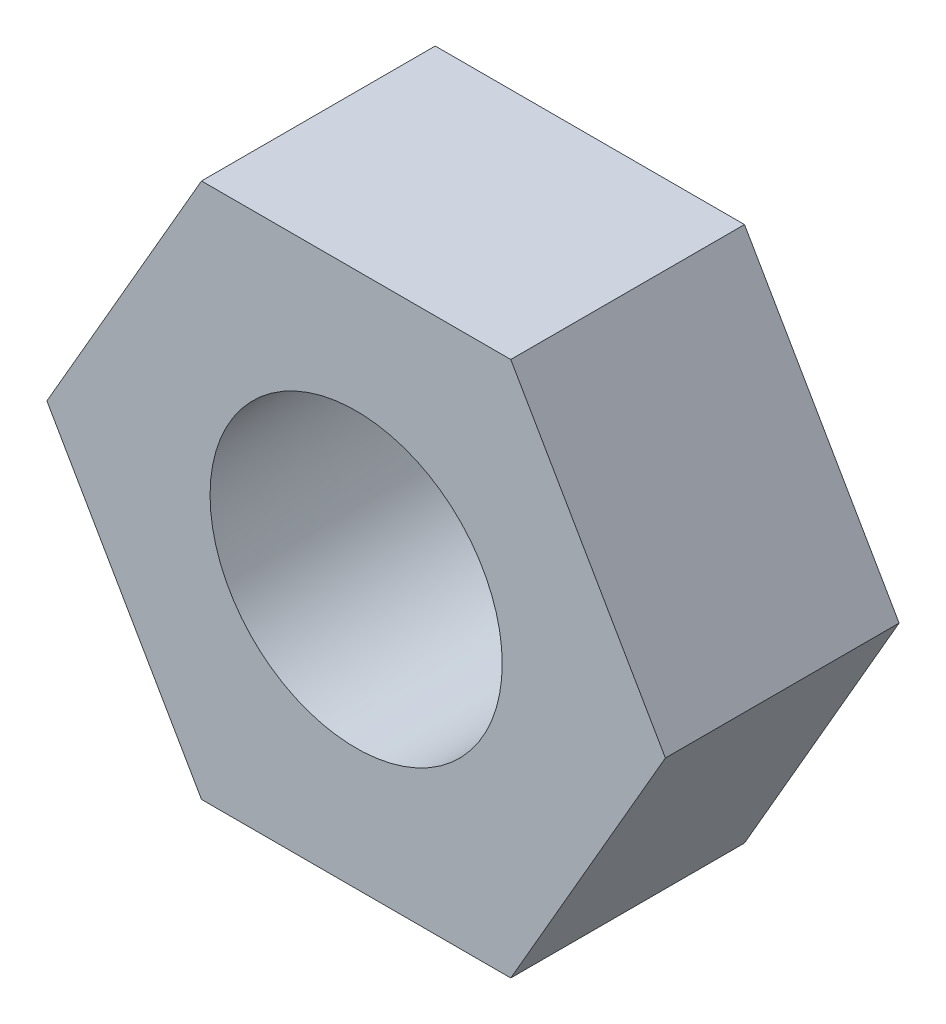
from build123d import *

# Parameters (mm, degrees)
ACROSS_FLATS_5_5_R                   = 1.5
NUT_THREAD_ENVELOPE_HEIGHT_2_4_DEPTH = 2.4


with BuildPart() as part:
    # Across_flats_5.5 → Nut_thread_envelope_height_2.4 (new body)
    with BuildSketch(Plane.XY):
        Polygon((3.175426481, 0), (1.58771324, 2.75), (-1.58771324, 2.75), (-3.175426481, 0), (-1.58771324, -2.75), (1.58771324, -2.75), align=None)
        Circle(ACROSS_FLATS_5_5_R, mode=Mode.SUBTRACT)
    extrude(amount=NUT_THREAD_ENVELOPE_HEIGHT_2_4_DEPTH)


solid = part.part
